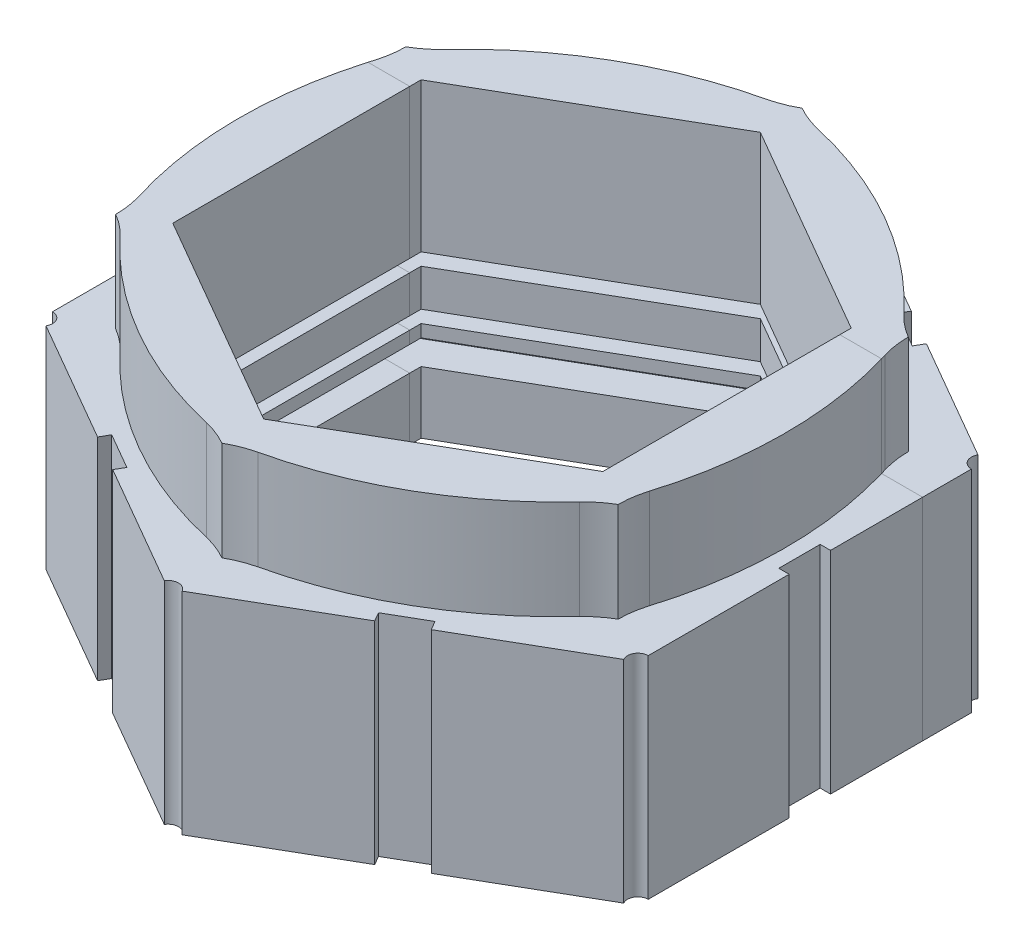
from build123d import *

# Parameters (mm, degrees)
TOP_XTRA_THICK_DEPTH              = 9
BOSS_EXTRUDE3_DEPTH               = 24
CUT_EXTRUDE4_DEPTH                = 24
SKETCH5_R                         = 2.5
HOUSE_WIREHOLE_DEPTH              = 50
SKETCH6_W                         = 5
SKETCH6_H                         = 10
ROAD_WIREHOLES_DEPTH              = 50
F_8MM_NOTCH_DEPTH                 = 9
SKETCH9_W                         = 3
SKETCH9_H                         = 25
LED_SPACEMAKERS_DEPTH             = 3
SKETCH10_W                        = 3
SKETCH10_H                        = 25
BOSS_EXTRUDE6_DEPTH               = 3
LED_NOTCH_WIRE_COVER_DEPTH        = 3
BOSS_EXTRUDE12_DEPTH              = 3
LED_WIREHOLE_DEPTH                = 3
NORMAL_LAYER_DEPTH                = 3
F_8MM_NOTCH_2_DEPTH               = 3
LED_WIREHOLE_2_DEPTH              = 3
BOSS_EXTRUDE15_DEPTH              = 3
CUT_EXTRUDE10_DEPTH               = 50
ELECTRONICS_CEILING_NOTCH_DEPTH   = 6
NORMAL_LAYERS_ELECTRONICS_DEPTH   = 6
BIGGER_WIREHOLE_ELECTRONICS_DEPTH = 6
BOSS_EXTRUDE19_DEPTH              = 9
SPLIT1_SURFACE_1_BACK             = 231.505
SPLIT1_SURFACE_1_DEPTH            = 463.01
SPLIT1_SURFACE_2_BACK             = 231.505
SPLIT1_SURFACE_2_DEPTH            = 463.01


with BuildPart() as part:
    # Sketch1 → top xtra thick (new body)
    with BuildSketch(Plane(origin=(0, 0, 0), x_dir=(1, 0, 0), z_dir=(0, 1, 0))):
        Polygon((0, 83.094010768), (-71.961524227, 41.547005384), (-71.961524227, -41.547005384), (0, -83.094010768), (71.961524227, -41.547005384), (71.961524227, 41.547005384), align=None)
        Polygon((0, 60), (-51.961524227, 30), (-51.961524227, -30), (0, -60), (51.961524227, -30), (51.961524227, 30), align=None, mode=Mode.SUBTRACT)
    extrude(amount=TOP_XTRA_THICK_DEPTH)

    # Sketch4 → Boss-Extrude3 (add)
    with BuildSketch(Plane(origin=(0, 9, 0), x_dir=(1, 0, 0), z_dir=(0, 1, 0))):
        Polygon((71.961524227, 41.547005384), (0, 83.094010768), (-71.961524227, 41.547005384), (-71.961524227, -41.547005384), (0, -83.094010768), (71.961524227, -41.547005384), align=None)
        Polygon((-51.961524227, -30), (0, -60), (51.961524227, -30), (51.961524227, 30), (0, 60), (-51.961524227, 30), align=None, mode=Mode.SUBTRACT)
    extrude(amount=BOSS_EXTRUDE3_DEPTH)

    # pattern cutout → Cut-Extrude4 (cut)
    # profile 1 of 2: a face of its own
    with BuildSketch(Plane(origin=(0, 9, 0), x_dir=(1, 0, 0), z_dir=(0, 1, 0))):
        Polygon((71.961524227, -41.547005384), (71.961524227, 41.547005384), (0, 83.094010768), (-71.961524227, 41.547005384), (-71.961524227, -41.547005384), (0, -83.094010768), align=None)
        with BuildLine():
            ThreePointArc((-32.980762114, 57.124355653), (-19.992099258, 63.384759198), (-6.218315044, 67.648663955))
            ThreePointArc((-6.218315044, 67.648663955), (-3.017945161, 68.639391859), (0, 70.094010768))
            ThreePointArc((0, 70.094010768), (3.017945161, 68.639391859), (6.218315044, 67.648663955))
            ThreePointArc((6.218315044, 67.648663955), (19.992099258, 63.384759198), (32.980762114, 57.124355653))
            ThreePointArc((32.980762114, 57.124355653), (44.89676205, 49.006045431), (55.476303995, 39.209550774))
            ThreePointArc((55.476303995, 39.209550774), (57.934484469, 36.933313107), (60.703193978, 35.047005384))
            ThreePointArc((60.703193978, 35.047005384), (60.952429631, 31.706078752), (61.694619039, 28.43911318))
            ThreePointArc((61.694619039, 28.43911318), (64.888861307, 14.378713767), (65.961524227, 0))
            ThreePointArc((65.961524227, 0), (64.888861307, -14.378713767), (61.694619039, -28.43911318))
            ThreePointArc((61.694619039, -28.43911318), (60.952429631, -31.706078752), (60.703193978, -35.047005384))
            ThreePointArc((60.703193978, -35.047005384), (57.934484469, -36.933313107), (55.476303995, -39.209550774))
            ThreePointArc((55.476303995, -39.209550774), (44.89676205, -49.006045431), (32.980762114, -57.124355653))
            ThreePointArc((32.980762114, -57.124355653), (19.992099258, -63.384759198), (6.218315044, -67.648663955))
            ThreePointArc((6.218315044, -67.648663955), (3.017945161, -68.639391859), (0, -70.094010768))
            ThreePointArc((0, -70.094010768), (-3.017945161, -68.639391859), (-6.218315044, -67.648663955))
            ThreePointArc((-6.218315044, -67.648663955), (-19.992099258, -63.384759198), (-32.980762114, -57.124355653))
            ThreePointArc((-32.980762114, -57.124355653), (-44.89676205, -49.006045431), (-55.476303995, -39.209550774))
            ThreePointArc((-55.476303995, -39.209550774), (-57.934484469, -36.933313107), (-60.703193978, -35.047005384))
            ThreePointArc((-60.703193978, -35.047005384), (-60.952429631, -31.706078752), (-61.694619039, -28.43911318))
            ThreePointArc((-61.694619039, -28.43911318), (-64.888861307, -14.378713767), (-65.961524227, 0))
            ThreePointArc((-65.961524227, 0), (-64.888861307, 14.378713767), (-61.694619039, 28.43911318))
            ThreePointArc((-61.694619039, 28.43911318), (-60.952429631, 31.706078752), (-60.703193978, 35.047005384))
            ThreePointArc((-60.703193978, 35.047005384), (-57.934484469, 36.933313107), (-55.476303995, 39.209550774))
            ThreePointArc((-55.476303995, 39.209550774), (-44.89676205, 49.006045431), (-32.980762114, 57.124355653))
        make_face(mode=Mode.SUBTRACT)
    # profile 2 of 2: a face of its own
    with BuildSketch(Plane(origin=(0, 9, 0), x_dir=(1, 0, 0), z_dir=(0, 1, 0))):
        Polygon((71.961524227, -41.547005384), (71.961524227, 41.547005384), (0, 83.094010768), (-71.961524227, 41.547005384), (-71.961524227, -41.547005384), (0, -83.094010768), align=None)
        with BuildLine():
            ThreePointArc((-32.980762114, 57.124355653), (-19.992099258, 63.384759198), (-6.218315044, 67.648663955))
            ThreePointArc((-6.218315044, 67.648663955), (-3.017945161, 68.639391859), (0, 70.094010768))
            ThreePointArc((0, 70.094010768), (3.017945161, 68.639391859), (6.218315044, 67.648663955))
            ThreePointArc((6.218315044, 67.648663955), (19.992099258, 63.384759198), (32.980762114, 57.124355653))
            ThreePointArc((32.980762114, 57.124355653), (44.89676205, 49.006045431), (55.476303995, 39.209550774))
            ThreePointArc((55.476303995, 39.209550774), (57.934484469, 36.933313107), (60.703193978, 35.047005384))
            ThreePointArc((60.703193978, 35.047005384), (60.952429631, 31.706078752), (61.694619039, 28.43911318))
            ThreePointArc((61.694619039, 28.43911318), (64.888861307, 14.378713767), (65.961524227, 0))
            ThreePointArc((65.961524227, 0), (64.888861307, -14.378713767), (61.694619039, -28.43911318))
            ThreePointArc((61.694619039, -28.43911318), (60.952429631, -31.706078752), (60.703193978, -35.047005384))
            ThreePointArc((60.703193978, -35.047005384), (57.934484469, -36.933313107), (55.476303995, -39.209550774))
            ThreePointArc((55.476303995, -39.209550774), (44.89676205, -49.006045431), (32.980762114, -57.124355653))
            ThreePointArc((32.980762114, -57.124355653), (19.992099258, -63.384759198), (6.218315044, -67.648663955))
            ThreePointArc((6.218315044, -67.648663955), (3.017945161, -68.639391859), (0, -70.094010768))
            ThreePointArc((0, -70.094010768), (-3.017945161, -68.639391859), (-6.218315044, -67.648663955))
            ThreePointArc((-6.218315044, -67.648663955), (-19.992099258, -63.384759198), (-32.980762114, -57.124355653))
            ThreePointArc((-32.980762114, -57.124355653), (-44.89676205, -49.006045431), (-55.476303995, -39.209550774))
            ThreePointArc((-55.476303995, -39.209550774), (-57.934484469, -36.933313107), (-60.703193978, -35.047005384))
            ThreePointArc((-60.703193978, -35.047005384), (-60.952429631, -31.706078752), (-61.694619039, -28.43911318))
            ThreePointArc((-61.694619039, -28.43911318), (-64.888861307, -14.378713767), (-65.961524227, 0))
            ThreePointArc((-65.961524227, 0), (-64.888861307, 14.378713767), (-61.694619039, 28.43911318))
            ThreePointArc((-61.694619039, 28.43911318), (-60.952429631, 31.706078752), (-60.703193978, 35.047005384))
            ThreePointArc((-60.703193978, 35.047005384), (-57.934484469, 36.933313107), (-55.476303995, 39.209550774))
            ThreePointArc((-55.476303995, 39.209550774), (-44.89676205, 49.006045431), (-32.980762114, 57.124355653))
        make_face(mode=Mode.SUBTRACT)
    extrude(amount=CUT_EXTRUDE4_DEPTH, mode=Mode.SUBTRACT)

    # Sketch5 → house wirehole (cut)
    with BuildSketch(Plane(origin=(0, 9, 0), x_dir=(1, 0, 0), z_dir=(0, 1, 0))):
        with Locations((0, 83.094010768)):
            Circle(SKETCH5_R)
        with Locations((71.961524227, 41.547005384)):
            Circle(SKETCH5_R)
        with Locations((71.961524227, -41.547005384)):
            Circle(SKETCH5_R)
        with Locations((0, -83.094010768)):
            Circle(SKETCH5_R)
        with Locations((-71.961524227, -41.547005384)):
            Circle(SKETCH5_R)
        with Locations((-71.961524227, 41.547005384)):
            Circle(SKETCH5_R)
    extrude(amount=-HOUSE_WIREHOLE_DEPTH, mode=Mode.SUBTRACT)

    # Sketch6 → road wireholes (cut)
    with BuildSketch(Plane(origin=(0, 9, 0), x_dir=(1, 0, 0), z_dir=(0, 1, 0))):
        with Locations((-71.961524227, 0)):
            Rectangle(SKETCH6_W, SKETCH6_H)
        Polygon((-32.900635095, 66.985571585), (-41.560889132, 61.985571585), (-39.060889132, 57.655444566), (-30.400635095, 62.655444566), align=None)
        Polygon((41.560889132, 61.985571585), (32.900635095, 66.985571585), (30.400635095, 62.655444566), (39.060889132, 57.655444566), align=None)
        with Locations((71.961524227, 0)):
            Rectangle(SKETCH6_W, SKETCH6_H)
        Polygon((32.900635095, -66.985571585), (41.560889132, -61.985571585), (39.060889132, -57.655444566), (30.400635095, -62.655444566), align=None)
        Polygon((-41.560889132, -61.985571585), (-32.900635095, -66.985571585), (-30.400635095, -62.655444566), (-39.060889132, -57.655444566), align=None)
    extrude(amount=-ROAD_WIREHOLES_DEPTH, mode=Mode.SUBTRACT)

    # Sketch7 → 8mm notch (add)
    with BuildSketch(Plane.XZ):
        with BuildLine():
            Line((40.310889132, 59.820508076), (39.060889132, 57.655444566))
            Line((39.060889132, 57.655444566), (30.400635095, 62.655444566))
            Line((30.400635095, 62.655444566), (31.650635095, 64.820508076))
            Line((31.650635095, 64.820508076), (2.165063509, 81.844010768))
            ThreePointArc((2.165063509, 81.844010768), (0, 80.594010768), (-2.165063509, 81.844010768))
            Line((-2.165063509, 81.844010768), (-31.650635095, 64.820508076))
            Line((-31.650635095, 64.820508076), (-30.400635095, 62.655444566))
            Line((-30.400635095, 62.655444566), (-39.060889132, 57.655444566))
            Line((-39.060889132, 57.655444566), (-40.310889132, 59.820508076))
            Line((-40.310889132, 59.820508076), (-69.796460718, 42.797005384))
            ThreePointArc((-69.796460718, 42.797005384), (-69.796460718, 40.297005384), (-71.961524227, 39.047005384))
            Line((-71.961524227, 39.047005384), (-71.961524227, 5))
            Line((-71.961524227, 5), (-69.461524227, 5))
            Line((-69.461524227, 5), (-69.461524227, -5))
            Line((-69.461524227, -5), (-71.961524227, -5))
            Line((-71.961524227, -5), (-71.961524227, -39.047005384))
            ThreePointArc((-71.961524227, -39.047005384), (-69.796460718, -40.297005384), (-69.796460718, -42.797005384))
            Line((-69.796460718, -42.797005384), (-40.310889132, -59.820508076))
            Line((-40.310889132, -59.820508076), (-39.060889132, -57.655444566))
            Line((-39.060889132, -57.655444566), (-30.400635095, -62.655444566))
            Line((-30.400635095, -62.655444566), (-31.650635095, -64.820508076))
            Line((-31.650635095, -64.820508076), (-2.165063509, -81.844010768))
            ThreePointArc((-2.165063509, -81.844010768), (0, -80.594010768), (2.165063509, -81.844010768))
            Line((2.165063509, -81.844010768), (31.650635095, -64.820508076))
            Line((31.650635095, -64.820508076), (30.400635095, -62.655444566))
            Line((30.400635095, -62.655444566), (39.060889132, -57.655444566))
            Line((39.060889132, -57.655444566), (40.310889132, -59.820508076))
            Line((40.310889132, -59.820508076), (69.796460718, -42.797005384))
            ThreePointArc((69.796460718, -42.797005384), (69.796460718, -40.297005384), (71.961524227, -39.047005384))
            Line((71.961524227, -39.047005384), (71.961524227, -5))
            Line((71.961524227, -5), (69.461524227, -5))
            Line((69.461524227, -5), (69.461524227, 5))
            Line((69.461524227, 5), (71.961524227, 5))
            Line((71.961524227, 5), (71.961524227, 39.047005384))
            ThreePointArc((71.961524227, 39.047005384), (69.796460718, 40.297005384), (69.796460718, 42.797005384))
            Line((69.796460718, 42.797005384), (40.310889132, 59.820508076))
        make_face()
        Polygon((0, -69.237604307), (59.961524227, -34.618802154), (59.961524227, 34.618802154), (0, 69.237604307), (-59.961524227, 34.618802154), (-59.961524227, -34.618802154), align=None, mode=Mode.SUBTRACT)
    extrude(amount=F_8MM_NOTCH_DEPTH)

    # Sketch9 → LED spacemakers (cut)
    with BuildSketch(Plane.XZ):
        Polygon((-17.655444566, 55.580127019), (-19.155444566, 58.17820323), (-40.806079661, 45.67820323), (-39.306079661, 43.080127019), align=None)
        Polygon((40.806079661, 45.67820323), (19.155444566, 58.17820323), (17.655444566, 55.580127019), (39.306079661, 43.080127019), align=None)
        with Locations((58.461524227, 0)):
            Rectangle(SKETCH9_W, SKETCH9_H)
        Polygon((19.155444566, -58.17820323), (40.806079661, -45.67820323), (39.306079661, -43.080127019), (17.655444566, -55.580127019), align=None)
        Polygon((-40.806079661, -45.67820323), (-19.155444566, -58.17820323), (-17.655444566, -55.580127019), (-39.306079661, -43.080127019), align=None)
        with Locations((-58.461524227, 0)):
            Rectangle(SKETCH9_W, SKETCH9_H)
    extrude(amount=-LED_SPACEMAKERS_DEPTH, mode=Mode.SUBTRACT)

    # Sketch10 → Boss-Extrude6 (add)
    with BuildSketch(Plane.XZ.offset(9)):
        with BuildLine():
            Line((40.310889132, 59.820508076), (39.060889132, 57.655444566))
            Line((39.060889132, 57.655444566), (30.400635095, 62.655444566))
            Line((30.400635095, 62.655444566), (31.650635095, 64.820508076))
            Line((31.650635095, 64.820508076), (2.165063509, 81.844010768))
            ThreePointArc((2.165063509, 81.844010768), (0, 80.594010768), (-2.165063509, 81.844010768))
            Line((-2.165063509, 81.844010768), (-31.650635095, 64.820508076))
            Line((-31.650635095, 64.820508076), (-30.400635095, 62.655444566))
            Line((-30.400635095, 62.655444566), (-39.060889132, 57.655444566))
            Line((-39.060889132, 57.655444566), (-40.310889132, 59.820508076))
            Line((-40.310889132, 59.820508076), (-69.796460718, 42.797005384))
            ThreePointArc((-69.796460718, 42.797005384), (-69.796460718, 40.297005384), (-71.961524227, 39.047005384))
            Line((-71.961524227, 39.047005384), (-71.961524227, 5))
            Line((-71.961524227, 5), (-69.461524227, 5))
            Line((-69.461524227, 5), (-69.461524227, -5))
            Line((-69.461524227, -5), (-71.961524227, -5))
            Line((-71.961524227, -5), (-71.961524227, -39.047005384))
            ThreePointArc((-71.961524227, -39.047005384), (-69.796460718, -40.297005384), (-69.796460718, -42.797005384))
            Line((-69.796460718, -42.797005384), (-40.310889132, -59.820508076))
            Line((-40.310889132, -59.820508076), (-39.060889132, -57.655444566))
            Line((-39.060889132, -57.655444566), (-30.400635095, -62.655444566))
            Line((-30.400635095, -62.655444566), (-31.650635095, -64.820508076))
            Line((-31.650635095, -64.820508076), (-2.165063509, -81.844010768))
            ThreePointArc((-2.165063509, -81.844010768), (0, -80.594010768), (2.165063509, -81.844010768))
            Line((2.165063509, -81.844010768), (31.650635095, -64.820508076))
            Line((31.650635095, -64.820508076), (30.400635095, -62.655444566))
            Line((30.400635095, -62.655444566), (39.060889132, -57.655444566))
            Line((39.060889132, -57.655444566), (40.310889132, -59.820508076))
            Line((40.310889132, -59.820508076), (69.796460718, -42.797005384))
            ThreePointArc((69.796460718, -42.797005384), (69.796460718, -40.297005384), (71.961524227, -39.047005384))
            Line((71.961524227, -39.047005384), (71.961524227, -5))
            Line((71.961524227, -5), (69.461524227, -5))
            Line((69.461524227, -5), (69.461524227, 5))
            Line((69.461524227, 5), (71.961524227, 5))
            Line((71.961524227, 5), (71.961524227, 39.047005384))
            ThreePointArc((71.961524227, 39.047005384), (69.796460718, 40.297005384), (69.796460718, 42.797005384))
            Line((69.796460718, 42.797005384), (40.310889132, 59.820508076))
        make_face()
        Polygon((-39.306079661, 43.080127019), (-40.806079661, 45.67820323), (-19.155444566, 58.17820323), (-17.655444566, 55.580127019), align=None, mode=Mode.SUBTRACT)
        Polygon((17.655444566, 55.580127019), (19.155444566, 58.17820323), (40.806079661, 45.67820323), (39.306079661, 43.080127019), align=None, mode=Mode.SUBTRACT)
        with Locations((58.461524227, 0)):
            Rectangle(SKETCH10_W, SKETCH10_H, mode=Mode.SUBTRACT)
        Polygon((39.306079661, -43.080127019), (40.806079661, -45.67820323), (19.155444566, -58.17820323), (17.655444566, -55.580127019), align=None, mode=Mode.SUBTRACT)
        Polygon((-17.655444566, -55.580127019), (-19.155444566, -58.17820323), (-40.806079661, -45.67820323), (-39.306079661, -43.080127019), align=None, mode=Mode.SUBTRACT)
        with Locations((-58.461524227, 0)):
            Rectangle(SKETCH10_W, SKETCH10_H, mode=Mode.SUBTRACT)
        Polygon((51.961524227, -30), (0, -60), (-51.961524227, -30), (-51.961524227, 30), (0, 60), (51.961524227, 30), align=None, mode=Mode.SUBTRACT)
    extrude(amount=BOSS_EXTRUDE6_DEPTH)

    # Sketch16 → LED notch wire cover (add)
    with BuildSketch(Plane.XZ):
        Polygon((0, 65.773502692), (-56.961524227, 32.886751346), (-56.961524227, -32.886751346), (0, -65.773502692), (56.961524227, -32.886751346), (56.961524227, 32.886751346), align=None)
        Polygon((0, -60), (51.961524227, -30), (51.961524227, 30), (0, 60), (-51.961524227, 30), (-51.961524227, -30), align=None, mode=Mode.SUBTRACT)
    extrude(amount=LED_NOTCH_WIRE_COVER_DEPTH)

    # Sketch17 → Boss-Extrude12 (add)
    with BuildSketch(Plane(origin=(0, -9, 0), x_dir=(1, 0, 0), z_dir=(0, 1, 0))):
        Polygon((-56.961524227, -32.886751346), (0, -65.773502692), (56.961524227, -32.886751346), (56.961524227, 32.886751346), (0, 65.773502692), (-56.961524227, 32.886751346), align=None)
        Polygon((51.961524227, 30), (0, 60), (-51.961524227, 30), (-51.961524227, -30), (0, -60), (51.961524227, -30), align=None, mode=Mode.SUBTRACT)
    extrude(amount=BOSS_EXTRUDE12_DEPTH)

    # Sketch19 → LED wirehole (cut)
    with BuildSketch(Plane.XZ.offset(12)):
        Polygon((6.495190528, -62.023502692), (7.995190528, -64.621578903), (0, -69.237604307), (-7.995190528, -64.621578903), (-6.495190528, -62.023502692), (0, -65.773502692), align=None)
        Polygon((6.495190528, 62.023502692), (0, 65.773502692), (-6.495190528, 62.023502692), (-7.995190528, 64.621578903), (0, 69.237604307), (7.995190528, 64.621578903), align=None)
    extrude(amount=-LED_WIREHOLE_DEPTH, mode=Mode.SUBTRACT)

    # Sketch12 → Normal layer (add)
    with BuildSketch(Plane.XZ.offset(12)):
        with BuildLine():
            Line((40.310889132, 59.820508076), (39.060889132, 57.655444566))
            Line((39.060889132, 57.655444566), (30.400635095, 62.655444566))
            Line((30.400635095, 62.655444566), (31.650635095, 64.820508076))
            Line((31.650635095, 64.820508076), (2.165063509, 81.844010768))
            ThreePointArc((2.165063509, 81.844010768), (0, 80.594010768), (-2.165063509, 81.844010768))
            Line((-2.165063509, 81.844010768), (-31.650635095, 64.820508076))
            Line((-31.650635095, 64.820508076), (-30.400635095, 62.655444566))
            Line((-30.400635095, 62.655444566), (-39.060889132, 57.655444566))
            Line((-39.060889132, 57.655444566), (-40.310889132, 59.820508076))
            Line((-40.310889132, 59.820508076), (-69.796460718, 42.797005384))
            ThreePointArc((-69.796460718, 42.797005384), (-69.796460718, 40.297005384), (-71.961524227, 39.047005384))
            Line((-71.961524227, 39.047005384), (-71.961524227, 5))
            Line((-71.961524227, 5), (-69.461524227, 5))
            Line((-69.461524227, 5), (-69.461524227, -5))
            Line((-69.461524227, -5), (-71.961524227, -5))
            Line((-71.961524227, -5), (-71.961524227, -39.047005384))
            ThreePointArc((-71.961524227, -39.047005384), (-69.796460718, -40.297005384), (-69.796460718, -42.797005384))
            Line((-69.796460718, -42.797005384), (-40.310889132, -59.820508076))
            Line((-40.310889132, -59.820508076), (-39.060889132, -57.655444566))
            Line((-39.060889132, -57.655444566), (-30.400635095, -62.655444566))
            Line((-30.400635095, -62.655444566), (-31.650635095, -64.820508076))
            Line((-31.650635095, -64.820508076), (-2.165063509, -81.844010768))
            ThreePointArc((-2.165063509, -81.844010768), (0, -80.594010768), (2.165063509, -81.844010768))
            Line((2.165063509, -81.844010768), (31.650635095, -64.820508076))
            Line((31.650635095, -64.820508076), (30.400635095, -62.655444566))
            Line((30.400635095, -62.655444566), (39.060889132, -57.655444566))
            Line((39.060889132, -57.655444566), (40.310889132, -59.820508076))
            Line((40.310889132, -59.820508076), (69.796460718, -42.797005384))
            ThreePointArc((69.796460718, -42.797005384), (69.796460718, -40.297005384), (71.961524227, -39.047005384))
            Line((71.961524227, -39.047005384), (71.961524227, -5))
            Line((71.961524227, -5), (69.461524227, -5))
            Line((69.461524227, -5), (69.461524227, 5))
            Line((69.461524227, 5), (71.961524227, 5))
            Line((71.961524227, 5), (71.961524227, 39.047005384))
            ThreePointArc((71.961524227, 39.047005384), (69.796460718, 40.297005384), (69.796460718, 42.797005384))
            Line((69.796460718, 42.797005384), (40.310889132, 59.820508076))
        make_face()
        Polygon((-51.961524227, -30), (0, -60), (51.961524227, -30), (51.961524227, 30), (0, 60), (-51.961524227, 30), align=None, mode=Mode.SUBTRACT)
    extrude(amount=NORMAL_LAYER_DEPTH)

    # Sketch20 → 8mm notch 2 (add)
    with BuildSketch(Plane.XZ.offset(15)):
        with BuildLine():
            Line((69.796460718, 42.797005384), (40.310889132, 59.820508076))
            Line((40.310889132, 59.820508076), (39.060889132, 57.655444566))
            Line((39.060889132, 57.655444566), (30.400635095, 62.655444566))
            Line((30.400635095, 62.655444566), (31.650635095, 64.820508076))
            Line((31.650635095, 64.820508076), (2.165063509, 81.844010768))
            ThreePointArc((2.165063509, 81.844010768), (0, 80.594010768), (-2.165063509, 81.844010768))
            Line((-2.165063509, 81.844010768), (-31.650635095, 64.820508076))
            Line((-31.650635095, 64.820508076), (-30.400635095, 62.655444566))
            Line((-30.400635095, 62.655444566), (-39.060889132, 57.655444566))
            Line((-39.060889132, 57.655444566), (-40.310889132, 59.820508076))
            Line((-40.310889132, 59.820508076), (-69.796460718, 42.797005384))
            ThreePointArc((-69.796460718, 42.797005384), (-69.796460718, 40.297005384), (-71.961524227, 39.047005384))
            Line((-71.961524227, 39.047005384), (-71.961524227, 5))
            Line((-71.961524227, 5), (-69.461524227, 5))
            Line((-69.461524227, 5), (-69.461524227, -5))
            Line((-69.461524227, -5), (-71.961524227, -5))
            Line((-71.961524227, -5), (-71.961524227, -39.047005384))
            ThreePointArc((-71.961524227, -39.047005384), (-69.796460718, -40.297005384), (-69.796460718, -42.797005384))
            Line((-69.796460718, -42.797005384), (-40.310889132, -59.820508076))
            Line((-40.310889132, -59.820508076), (-39.060889132, -57.655444566))
            Line((-39.060889132, -57.655444566), (-30.400635095, -62.655444566))
            Line((-30.400635095, -62.655444566), (-31.650635095, -64.820508076))
            Line((-31.650635095, -64.820508076), (-2.165063509, -81.844010768))
            ThreePointArc((-2.165063509, -81.844010768), (0, -80.594010768), (2.165063509, -81.844010768))
            Line((2.165063509, -81.844010768), (31.650635095, -64.820508076))
            Line((31.650635095, -64.820508076), (30.400635095, -62.655444566))
            Line((30.400635095, -62.655444566), (39.060889132, -57.655444566))
            Line((39.060889132, -57.655444566), (40.310889132, -59.820508076))
            Line((40.310889132, -59.820508076), (69.796460718, -42.797005384))
            ThreePointArc((69.796460718, -42.797005384), (69.796460718, -40.297005384), (71.961524227, -39.047005384))
            Line((71.961524227, -39.047005384), (71.961524227, -5))
            Line((71.961524227, -5), (69.461524227, -5))
            Line((69.461524227, -5), (69.461524227, 5))
            Line((69.461524227, 5), (71.961524227, 5))
            Line((71.961524227, 5), (71.961524227, 39.047005384))
            ThreePointArc((71.961524227, 39.047005384), (69.796460718, 40.297005384), (69.796460718, 42.797005384))
        make_face()
        Polygon((-59.961524227, 34.618802154), (-59.961524227, -34.618802154), (0, -69.237604307), (59.961524227, -34.618802154), (59.961524227, 34.618802154), (0, 69.237604307), align=None, mode=Mode.SUBTRACT)
    extrude(amount=F_8MM_NOTCH_2_DEPTH)

    # Sketch21 → LED wirehole 2 (cut)
    with BuildSketch(Plane.XZ.offset(15)):
        Polygon((7.995190528, -64.621578903), (6.495190528, -62.023502692), (0, -65.773502692), (-6.495190528, -62.023502692), (-7.995190528, -64.621578903), (0, -69.237604307), align=None)
        Polygon((0, 65.773502692), (6.495190528, 62.023502692), (7.995190528, 64.621578903), (0, 69.237604307), (-7.995190528, 64.621578903), (-6.495190528, 62.023502692), align=None)
    extrude(amount=-LED_WIREHOLE_2_DEPTH, mode=Mode.SUBTRACT)

    # Sketch22 → Boss-Extrude15 (add)
    with BuildSketch(Plane.XZ.offset(18)):
        with BuildLine():
            Line((69.796460718, 42.797005384), (40.310889132, 59.820508076))
            Line((40.310889132, 59.820508076), (39.060889132, 57.655444566))
            Line((39.060889132, 57.655444566), (30.400635095, 62.655444566))
            Line((30.400635095, 62.655444566), (31.650635095, 64.820508076))
            Line((31.650635095, 64.820508076), (2.165063509, 81.844010768))
            ThreePointArc((2.165063509, 81.844010768), (0, 80.594010768), (-2.165063509, 81.844010768))
            Line((-2.165063509, 81.844010768), (-31.650635095, 64.820508076))
            Line((-31.650635095, 64.820508076), (-30.400635095, 62.655444566))
            Line((-30.400635095, 62.655444566), (-39.060889132, 57.655444566))
            Line((-39.060889132, 57.655444566), (-40.310889132, 59.820508076))
            Line((-40.310889132, 59.820508076), (-69.796460718, 42.797005384))
            ThreePointArc((-69.796460718, 42.797005384), (-69.796460718, 40.297005384), (-71.961524227, 39.047005384))
            Line((-71.961524227, 39.047005384), (-71.961524227, 5))
            Line((-71.961524227, 5), (-69.461524227, 5))
            Line((-69.461524227, 5), (-69.461524227, -5))
            Line((-69.461524227, -5), (-71.961524227, -5))
            Line((-71.961524227, -5), (-71.961524227, -39.047005384))
            ThreePointArc((-71.961524227, -39.047005384), (-69.796460718, -40.297005384), (-69.796460718, -42.797005384))
            Line((-69.796460718, -42.797005384), (-40.310889132, -59.820508076))
            Line((-40.310889132, -59.820508076), (-39.060889132, -57.655444566))
            Line((-39.060889132, -57.655444566), (-30.400635095, -62.655444566))
            Line((-30.400635095, -62.655444566), (-31.650635095, -64.820508076))
            Line((-31.650635095, -64.820508076), (-2.165063509, -81.844010768))
            ThreePointArc((-2.165063509, -81.844010768), (0, -80.594010768), (2.165063509, -81.844010768))
            Line((2.165063509, -81.844010768), (31.650635095, -64.820508076))
            Line((31.650635095, -64.820508076), (30.400635095, -62.655444566))
            Line((30.400635095, -62.655444566), (39.060889132, -57.655444566))
            Line((39.060889132, -57.655444566), (40.310889132, -59.820508076))
            Line((40.310889132, -59.820508076), (69.796460718, -42.797005384))
            ThreePointArc((69.796460718, -42.797005384), (69.796460718, -40.297005384), (71.961524227, -39.047005384))
            Line((71.961524227, -39.047005384), (71.961524227, -5))
            Line((71.961524227, -5), (69.461524227, -5))
            Line((69.461524227, -5), (69.461524227, 5))
            Line((69.461524227, 5), (71.961524227, 5))
            Line((71.961524227, 5), (71.961524227, 39.047005384))
            ThreePointArc((71.961524227, 39.047005384), (69.796460718, 40.297005384), (69.796460718, 42.797005384))
        make_face()
        Polygon((-51.961524227, -30), (0, -60), (51.961524227, -30), (51.961524227, 30), (0, 60), (-51.961524227, 30), align=None, mode=Mode.SUBTRACT)
    extrude(amount=BOSS_EXTRUDE15_DEPTH)

    # Sketch24 → Cut-Extrude10 (cut)
    with BuildSketch(Plane(origin=(0, -18, 0), x_dir=(1, 0, 0), z_dir=(0, 1, 0))):
        Polygon((6.495190528, -62.023502692), (0, -65.773502692), (-6.495190528, -62.023502692), (-7.995190528, -64.621578903), (0, -69.237604307), (7.995190528, -64.621578903), align=None)
        Polygon((6.495190528, 62.023502692), (7.995190528, 64.621578903), (0, 69.237604307), (-7.995190528, 64.621578903), (-6.495190528, 62.023502692), (0, 65.773502692), align=None)
    extrude(amount=-CUT_EXTRUDE10_DEPTH, mode=Mode.SUBTRACT)

    # Sketch25 → Electronics ceiling notch (add)
    with BuildSketch(Plane.XZ.offset(21)):
        with BuildLine():
            Line((69.796460718, 42.797005384), (40.310889132, 59.820508076))
            Line((40.310889132, 59.820508076), (39.060889132, 57.655444566))
            Line((39.060889132, 57.655444566), (30.400635095, 62.655444566))
            Line((30.400635095, 62.655444566), (31.650635095, 64.820508076))
            Line((31.650635095, 64.820508076), (2.165063509, 81.844010768))
            ThreePointArc((2.165063509, 81.844010768), (0, 80.594010768), (-2.165063509, 81.844010768))
            Line((-2.165063509, 81.844010768), (-31.650635095, 64.820508076))
            Line((-31.650635095, 64.820508076), (-30.400635095, 62.655444566))
            Line((-30.400635095, 62.655444566), (-39.060889132, 57.655444566))
            Line((-39.060889132, 57.655444566), (-40.310889132, 59.820508076))
            Line((-40.310889132, 59.820508076), (-69.796460718, 42.797005384))
            ThreePointArc((-69.796460718, 42.797005384), (-69.796460718, 40.297005384), (-71.961524227, 39.047005384))
            Line((-71.961524227, 39.047005384), (-71.961524227, 5))
            Line((-71.961524227, 5), (-69.461524227, 5))
            Line((-69.461524227, 5), (-69.461524227, -5))
            Line((-69.461524227, -5), (-71.961524227, -5))
            Line((-71.961524227, -5), (-71.961524227, -39.047005384))
            ThreePointArc((-71.961524227, -39.047005384), (-69.796460718, -40.297005384), (-69.796460718, -42.797005384))
            Line((-69.796460718, -42.797005384), (-40.310889132, -59.820508076))
            Line((-40.310889132, -59.820508076), (-39.060889132, -57.655444566))
            Line((-39.060889132, -57.655444566), (-30.400635095, -62.655444566))
            Line((-30.400635095, -62.655444566), (-31.650635095, -64.820508076))
            Line((-31.650635095, -64.820508076), (-2.165063509, -81.844010768))
            ThreePointArc((-2.165063509, -81.844010768), (0, -80.594010768), (2.165063509, -81.844010768))
            Line((2.165063509, -81.844010768), (31.650635095, -64.820508076))
            Line((31.650635095, -64.820508076), (30.400635095, -62.655444566))
            Line((30.400635095, -62.655444566), (39.060889132, -57.655444566))
            Line((39.060889132, -57.655444566), (40.310889132, -59.820508076))
            Line((40.310889132, -59.820508076), (69.796460718, -42.797005384))
            ThreePointArc((69.796460718, -42.797005384), (69.796460718, -40.297005384), (71.961524227, -39.047005384))
            Line((71.961524227, -39.047005384), (71.961524227, -5))
            Line((71.961524227, -5), (69.461524227, -5))
            Line((69.461524227, -5), (69.461524227, 5))
            Line((69.461524227, 5), (71.961524227, 5))
            Line((71.961524227, 5), (71.961524227, 39.047005384))
            ThreePointArc((71.961524227, 39.047005384), (69.796460718, 40.297005384), (69.796460718, 42.797005384))
        make_face()
        Polygon((-59.961524227, 34.618802154), (-59.961524227, -34.618802154), (0, -69.237604307), (59.961524227, -34.618802154), (59.961524227, 34.618802154), (0, 69.237604307), align=None, mode=Mode.SUBTRACT)
    extrude(amount=ELECTRONICS_CEILING_NOTCH_DEPTH)

    # Sketch26 → Normal layers electronics (add)
    with BuildSketch(Plane.XZ.offset(27)):
        with BuildLine():
            Line((71.961524227, -5), (69.461524227, -5))
            Line((69.461524227, -5), (69.461524227, 5))
            Line((69.461524227, 5), (71.961524227, 5))
            Line((71.961524227, 5), (71.961524227, 39.047005384))
            ThreePointArc((71.961524227, 39.047005384), (69.796460718, 40.297005384), (69.796460718, 42.797005384))
            Line((69.796460718, 42.797005384), (40.310889132, 59.820508076))
            Line((40.310889132, 59.820508076), (39.060889132, 57.655444566))
            Line((39.060889132, 57.655444566), (30.400635095, 62.655444566))
            Line((30.400635095, 62.655444566), (31.650635095, 64.820508076))
            Line((31.650635095, 64.820508076), (2.165063509, 81.844010768))
            ThreePointArc((2.165063509, 81.844010768), (0, 80.594010768), (-2.165063509, 81.844010768))
            Line((-2.165063509, 81.844010768), (-31.650635095, 64.820508076))
            Line((-31.650635095, 64.820508076), (-30.400635095, 62.655444566))
            Line((-30.400635095, 62.655444566), (-39.060889132, 57.655444566))
            Line((-39.060889132, 57.655444566), (-40.310889132, 59.820508076))
            Line((-40.310889132, 59.820508076), (-69.796460718, 42.797005384))
            ThreePointArc((-69.796460718, 42.797005384), (-69.796460718, 40.297005384), (-71.961524227, 39.047005384))
            Line((-71.961524227, 39.047005384), (-71.961524227, 5))
            Line((-71.961524227, 5), (-69.461524227, 5))
            Line((-69.461524227, 5), (-69.461524227, -5))
            Line((-69.461524227, -5), (-71.961524227, -5))
            Line((-71.961524227, -5), (-71.961524227, -39.047005384))
            ThreePointArc((-71.961524227, -39.047005384), (-69.796460718, -40.297005384), (-69.796460718, -42.797005384))
            Line((-69.796460718, -42.797005384), (-40.310889132, -59.820508076))
            Line((-40.310889132, -59.820508076), (-39.060889132, -57.655444566))
            Line((-39.060889132, -57.655444566), (-30.400635095, -62.655444566))
            Line((-30.400635095, -62.655444566), (-31.650635095, -64.820508076))
            Line((-31.650635095, -64.820508076), (-2.165063509, -81.844010768))
            ThreePointArc((-2.165063509, -81.844010768), (0, -80.594010768), (2.165063509, -81.844010768))
            Line((2.165063509, -81.844010768), (31.650635095, -64.820508076))
            Line((31.650635095, -64.820508076), (30.400635095, -62.655444566))
            Line((30.400635095, -62.655444566), (39.060889132, -57.655444566))
            Line((39.060889132, -57.655444566), (40.310889132, -59.820508076))
            Line((40.310889132, -59.820508076), (69.796460718, -42.797005384))
            ThreePointArc((69.796460718, -42.797005384), (69.796460718, -40.297005384), (71.961524227, -39.047005384))
            Line((71.961524227, -39.047005384), (71.961524227, -5))
        make_face()
        Polygon((51.961524227, -30), (51.961524227, 30), (0, 60), (-51.961524227, 30), (-51.961524227, -30), (0, -60), align=None, mode=Mode.SUBTRACT)
        Polygon((0, 65.773502692), (6.495190528, 62.023502692), (7.995190528, 64.621578903), (0, 69.237604307), (-7.995190528, 64.621578903), (-6.495190528, 62.023502692), align=None, mode=Mode.SUBTRACT)
        Polygon((7.995190528, -64.621578903), (6.495190528, -62.023502692), (0, -65.773502692), (-6.495190528, -62.023502692), (-7.995190528, -64.621578903), (0, -69.237604307), align=None, mode=Mode.SUBTRACT)
    extrude(amount=NORMAL_LAYERS_ELECTRONICS_DEPTH)

    # Sketch27 → Bigger wirehole electronics (cut)
    with BuildSketch(Plane.XZ.offset(33)):
        Polygon((-6.495190528, 62.023502692), (-3.995190528, 57.693375673), (0, 60), (3.995190528, 57.693375673), (6.495190528, 62.023502692), (0, 65.773502692), align=None)
        Polygon((0, -60), (-3.995190528, -57.693375673), (-6.495190528, -62.023502692), (0, -65.773502692), (6.495190528, -62.023502692), (3.995190528, -57.693375673), align=None)
    extrude(amount=-BIGGER_WIREHOLE_ELECTRONICS_DEPTH, mode=Mode.SUBTRACT)

    # Sketch29 → Boss-Extrude19 (add)
    with BuildSketch(Plane.XZ.offset(33)):
        with BuildLine():
            Line((71.961524227, -5), (69.461524227, -5))
            Line((69.461524227, -5), (69.461524227, 5))
            Line((69.461524227, 5), (71.961524227, 5))
            Line((71.961524227, 5), (71.961524227, 39.047005384))
            ThreePointArc((71.961524227, 39.047005384), (69.796460718, 40.297005384), (69.796460718, 42.797005384))
            Line((69.796460718, 42.797005384), (40.310889132, 59.820508076))
            Line((40.310889132, 59.820508076), (39.060889132, 57.655444566))
            Line((39.060889132, 57.655444566), (30.400635095, 62.655444566))
            Line((30.400635095, 62.655444566), (31.650635095, 64.820508076))
            Line((31.650635095, 64.820508076), (2.165063509, 81.844010768))
            ThreePointArc((2.165063509, 81.844010768), (0, 80.594010768), (-2.165063509, 81.844010768))
            Line((-2.165063509, 81.844010768), (-31.650635095, 64.820508076))
            Line((-31.650635095, 64.820508076), (-30.400635095, 62.655444566))
            Line((-30.400635095, 62.655444566), (-39.060889132, 57.655444566))
            Line((-39.060889132, 57.655444566), (-40.310889132, 59.820508076))
            Line((-40.310889132, 59.820508076), (-69.796460718, 42.797005384))
            ThreePointArc((-69.796460718, 42.797005384), (-69.796460718, 40.297005384), (-71.961524227, 39.047005384))
            Line((-71.961524227, 39.047005384), (-71.961524227, 5))
            Line((-71.961524227, 5), (-69.461524227, 5))
            Line((-69.461524227, 5), (-69.461524227, -5))
            Line((-69.461524227, -5), (-71.961524227, -5))
            Line((-71.961524227, -5), (-71.961524227, -39.047005384))
            ThreePointArc((-71.961524227, -39.047005384), (-69.796460718, -40.297005384), (-69.796460718, -42.797005384))
            Line((-69.796460718, -42.797005384), (-40.310889132, -59.820508076))
            Line((-40.310889132, -59.820508076), (-39.060889132, -57.655444566))
            Line((-39.060889132, -57.655444566), (-30.400635095, -62.655444566))
            Line((-30.400635095, -62.655444566), (-31.650635095, -64.820508076))
            Line((-31.650635095, -64.820508076), (-2.165063509, -81.844010768))
            ThreePointArc((-2.165063509, -81.844010768), (0, -80.594010768), (2.165063509, -81.844010768))
            Line((2.165063509, -81.844010768), (31.650635095, -64.820508076))
            Line((31.650635095, -64.820508076), (30.400635095, -62.655444566))
            Line((30.400635095, -62.655444566), (39.060889132, -57.655444566))
            Line((39.060889132, -57.655444566), (40.310889132, -59.820508076))
            Line((40.310889132, -59.820508076), (69.796460718, -42.797005384))
            ThreePointArc((69.796460718, -42.797005384), (69.796460718, -40.297005384), (71.961524227, -39.047005384))
            Line((71.961524227, -39.047005384), (71.961524227, -5))
        make_face()
        Polygon((51.961524227, -30), (51.961524227, 30), (0, 60), (-51.961524227, 30), (-51.961524227, -30), (0, -60), align=None, mode=Mode.SUBTRACT)
    extrude(amount=BOSS_EXTRUDE19_DEPTH)


with BuildPart() as body_2:
    # Split1: the piece behind the surface
    add(part.part)
    # Split1 surface: a surface, the sketch's curves swept straight by 463.01 mm
    with BuildLine(Plane(origin=(0, 33, 0), x_dir=(1, 0, 0), z_dir=(0, 1, 0)).offset(-SPLIT1_SURFACE_1_BACK), mode=Mode.PRIVATE) as split1_surface_1_path:
        Line((-113.272742431, 27.25), (112.489563204, 27.25))
    split1_surface_1 = Shell.extrude(split1_surface_1_path.wire(), (0 * SPLIT1_SURFACE_1_DEPTH, 1 * SPLIT1_SURFACE_1_DEPTH, 0 * SPLIT1_SURFACE_1_DEPTH))
    split(bisect_by=split1_surface_1, keep=Keep.BOTTOM)


with BuildPart() as part_1:
    add(part.part)

    # Split1: split by a surface, the side it looks to stays
    # Split1 surface: a surface, the sketch's curves swept straight by 463.01 mm
    with BuildLine(Plane(origin=(0, 33, 0), x_dir=(1, 0, 0), z_dir=(0, 1, 0)).offset(-SPLIT1_SURFACE_2_BACK), mode=Mode.PRIVATE) as split1_surface_2_path:
        Line((-113.272742431, 27.25), (112.489563204, 27.25))
    split1_surface_2 = Shell.extrude(split1_surface_2_path.wire(), (0 * SPLIT1_SURFACE_2_DEPTH, 1 * SPLIT1_SURFACE_2_DEPTH, 0 * SPLIT1_SURFACE_2_DEPTH))
    split(bisect_by=split1_surface_2, keep=Keep.TOP)


solid = Compound([body_2.part, part_1.part])
